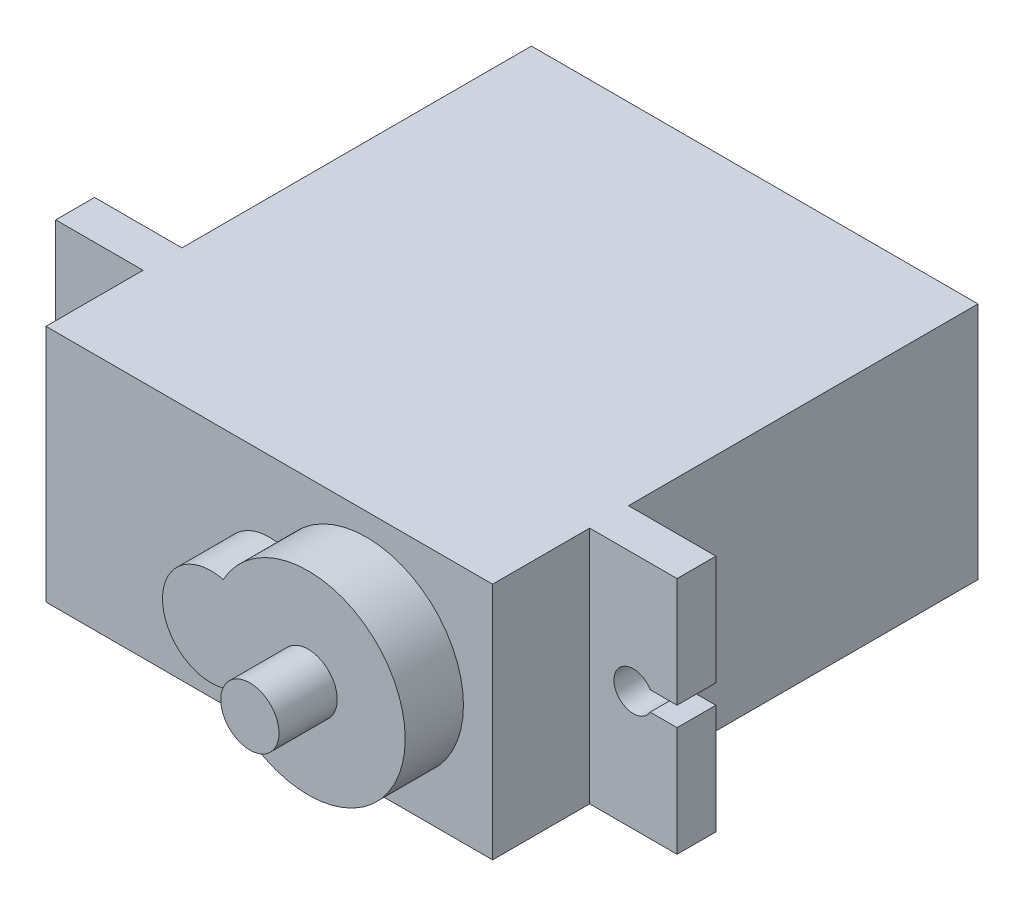
from build123d import *

# Parameters (mm, degrees)
SKETCH_1_W          = 23
SKETCH_1_H          = 12.3
EXTRUDE_1_DEPTH     = 25
SKETCH_3_R          = 5
SKETCH_3_R_2        = 2.5
EXTRUDE_2_DEPTH     = 3
SKETCH_4_R          = 1.5
EXTRUDE_3_DEPTH     = 3
EXTRUDE_START       = -5
SKETCH_5_W          = 4.5
SKETCH_5_H          = 12.3
EXTRUDE_4_DEPTH     = 2
SKETCH_6_R          = 1
CUT_EXTRUDE_1_DEPTH = 3
SKETCH_7_W          = 1.383974596
SKETCH_7_H          = 1
CUT_EXTRUDE_2_DEPTH = 10


with BuildPart() as part:
    # 草图1 → 凸台-拉伸1 (new body)
    with BuildSketch(Plane.XY):
        Rectangle(SKETCH_1_W, SKETCH_1_H)
    extrude(amount=EXTRUDE_1_DEPTH)

    # 草图3 → 凸台-拉伸2 (add)
    with BuildSketch(Plane.XY.offset(25)):
        with Locations((5, 0)):
            Circle(SKETCH_3_R)
        Circle(SKETCH_3_R_2)
    extrude(amount=EXTRUDE_2_DEPTH)

    # 草图4 → 凸台-拉伸3 (add)
    with BuildSketch(Plane.XY.offset(28)):
        with Locations((5, 0)):
            Circle(SKETCH_4_R)
    extrude(amount=EXTRUDE_3_DEPTH)

    # 草图5 → 凸台-拉伸4 (add)
    with BuildSketch(Plane.XY.offset(25).offset(EXTRUDE_START)):
        with Locations((-13.75, 0)):
            Rectangle(SKETCH_5_W, SKETCH_5_H)
        with Locations((13.75, 0)):
            Rectangle(SKETCH_5_W, SKETCH_5_H)
    extrude(amount=-EXTRUDE_4_DEPTH)

    # 草图6 → 切除-拉伸1 (cut)
    with BuildSketch(Plane.XY.offset(20)):
        with Locations((-13.75, 0)):
            Circle(SKETCH_6_R)
        with Locations(Location((13.75, 0, 0), (0, 0, 180))):
            Circle(SKETCH_6_R)
    extrude(amount=-CUT_EXTRUDE_1_DEPTH, mode=Mode.SUBTRACT)

    # 草图7 → 切除-拉伸2 (cut)
    with BuildSketch(Plane.XY.offset(20)):
        with Locations((-15.308012702, 0)):
            Rectangle(SKETCH_7_W, SKETCH_7_H)
        with Locations((15.308012702, 0)):
            Rectangle(SKETCH_7_W, SKETCH_7_H)
    extrude(amount=-CUT_EXTRUDE_2_DEPTH, mode=Mode.SUBTRACT)


solid = part.part
